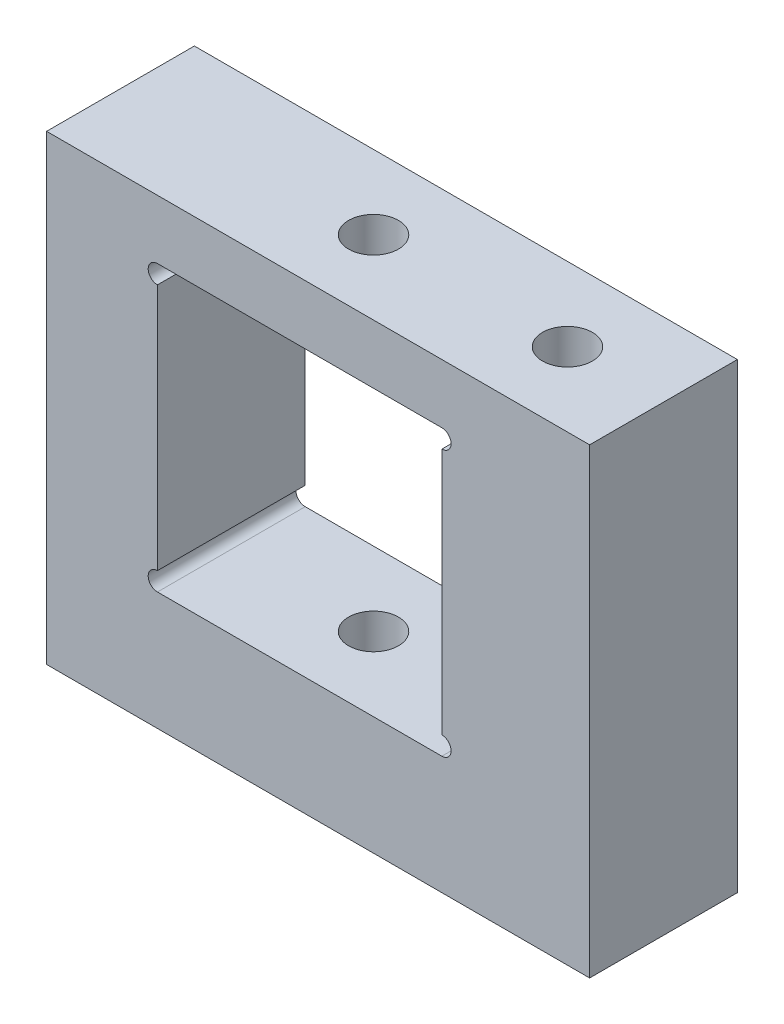
from build123d import *

# Parameters (mm, degrees)
SKETCH_2_W               = 29.4
SKETCH_2_H               = 25
EXTRUDE_1_DEPTH          = 8
CUT_EXTRUDE_1_DEPTH      = 31.58578101
CUT_EXTRUDE_1_DEPTH_BACK = 31.58578101
SKETCH_3_R               = 1.35


with BuildPart() as part:
    # 草图2 → 凸台-拉伸1 (new body)
    with BuildSketch(Plane.XY):
        with Locations((1, -1.6)):
            Rectangle(SKETCH_2_W, SKETCH_2_H)
        with BuildLine():
            ThreePointArc((8.2, -7.2), (8.053553391, -7.553553391), (7.7, -7.7))
            Line((7.7, -7.7), (-7.7, -7.7))
            ThreePointArc((-7.7, -7.7), (-8.2, -7.2), (-7.7, -6.7))
            Line((-7.7, -6.7), (-7.7, 6.7))
            ThreePointArc((-7.7, 6.7), (-8.2, 7.2), (-7.7, 7.7))
            Line((-7.7, 7.7), (7.7, 7.7))
            ThreePointArc((7.7, 7.7), (8.053553391, 7.553553391), (8.2, 7.2))
            ThreePointArc((8.2, 7.2), (8.053553391, 6.846446609), (7.7, 6.7))
            Line((7.7, 6.7), (7.7, -6.7))
            ThreePointArc((7.7, -6.7), (8.053553391, -6.846446609), (8.2, -7.2))
        make_face(mode=Mode.SUBTRACT)
    extrude(amount=EXTRUDE_1_DEPTH)

    # 草图3 → 切除-拉伸1 (cut, two sides: drawn at the far end of the back side and taken through both)
    with BuildSketch(Plane(origin=(0, 10.9, 0), x_dir=(1, 0, 0), z_dir=(0, 1, 0)).offset(-CUT_EXTRUDE_1_DEPTH_BACK)):
        with Locations(Location((10.5, -4, 0), (0, 0, 270))):
            Circle(SKETCH_3_R)
        with Locations((21, -4)):
            Circle(SKETCH_3_R)
        with Locations(Location((0, -4, 0), (0, 0, 270))):
            Circle(SKETCH_3_R)
    extrude(amount=CUT_EXTRUDE_1_DEPTH + CUT_EXTRUDE_1_DEPTH_BACK, mode=Mode.SUBTRACT)


solid = part.part
